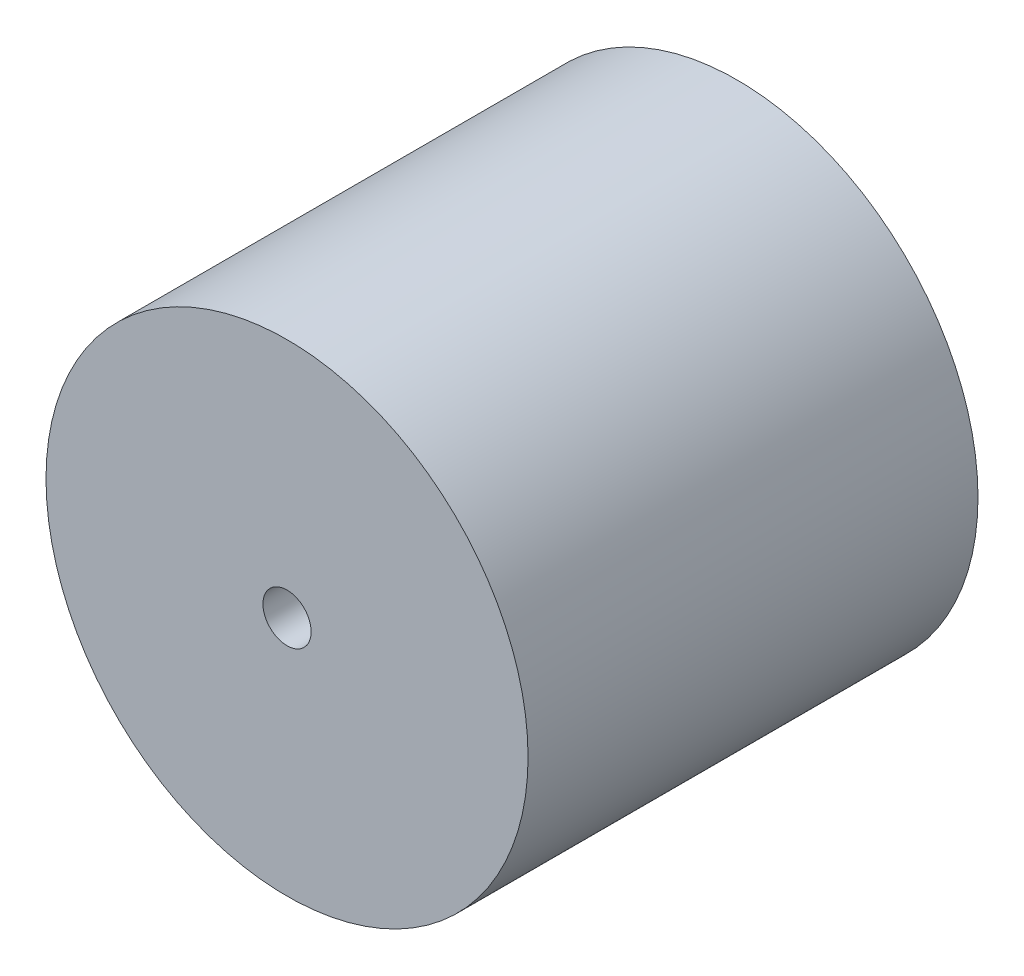
from build123d import *

# Parameters (mm, degrees)
SKETCH_1_R          = 15
EXTRUDE_2_DEPTH     = 28
SKETCH_3_R          = 1.5
CUT_EXTRUDE_3_DEPTH = 10
CUT_EXTRUDE_START   = -18
SKETCH_3_2_R        = 1.5
CUT_EXTRUDE_4_DEPTH = 10


with BuildPart() as part:
    # 草图1 → 凸台-拉伸2 (new body)
    with BuildSketch(Plane.XY):
        Circle(SKETCH_1_R)
    extrude(amount=EXTRUDE_2_DEPTH)

    # 草图3 → 切除-拉伸3 (cut)
    with BuildSketch(Plane.XY.offset(28)):
        Circle(SKETCH_3_R)
    extrude(amount=-CUT_EXTRUDE_3_DEPTH, mode=Mode.SUBTRACT)

    # 草图3<2> → 切除-拉伸4 (cut)
    with BuildSketch(Plane.XY.offset(28).offset(CUT_EXTRUDE_START)):
        Circle(SKETCH_3_2_R)
    extrude(amount=-CUT_EXTRUDE_4_DEPTH, mode=Mode.SUBTRACT)


solid = part.part
